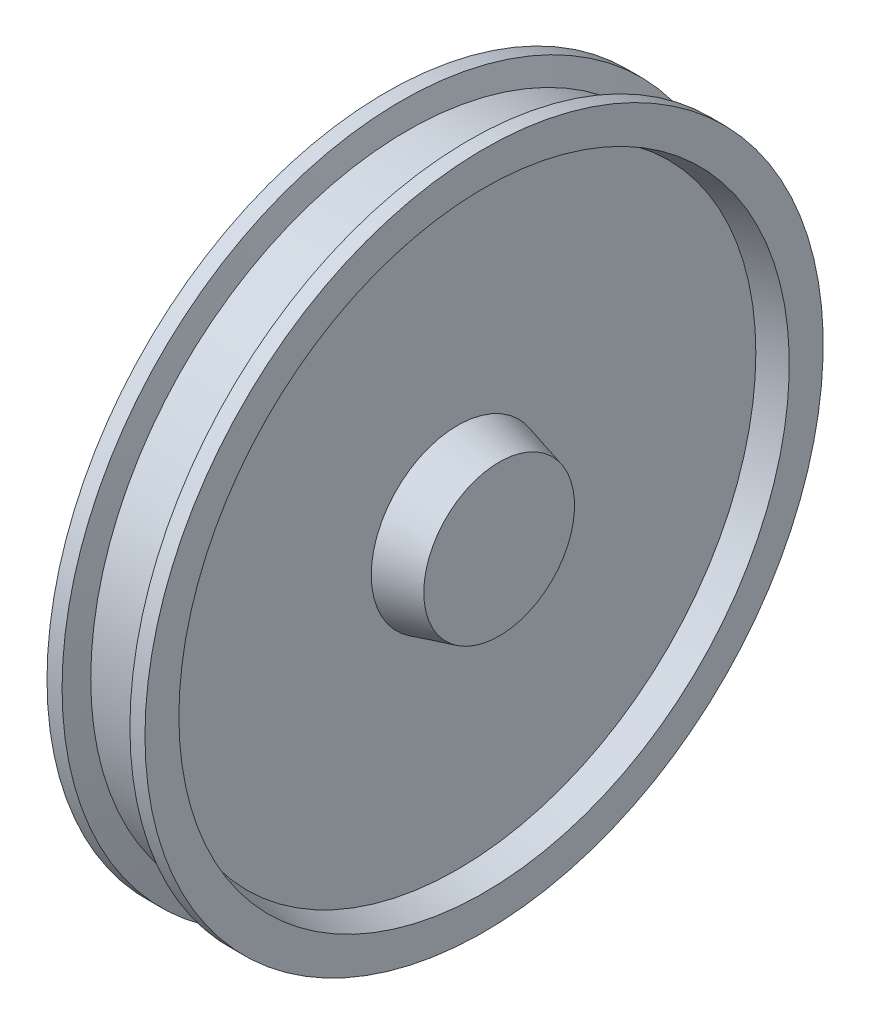
from build123d import *


with BuildPart() as part:
    # Esquisse2 → Révolution1 (revolve)
    with BuildSketch(Plane.XY, mode=Mode.PRIVATE) as r_volution1_sk:
        Polygon((-85, 0), (-85, 100), (-30, 114.737205584), (-30, 395.621778265), (-65, 405), (-65, 450), (-45, 450), (-36.961524227, 420), (36.961524227, 420), (45, 450), (65, 450), (65, 405), (30, 395.621778265), (30, 114.737205584), (85, 100), (85, 0), align=None)
    revolve(r_volution1_sk.sketch.rotate(Axis((-85, 0, 0), (1, 0, 0)), 90), axis=Axis((-85, 0, 0), (1, 0, 0)))


solid = part.part
